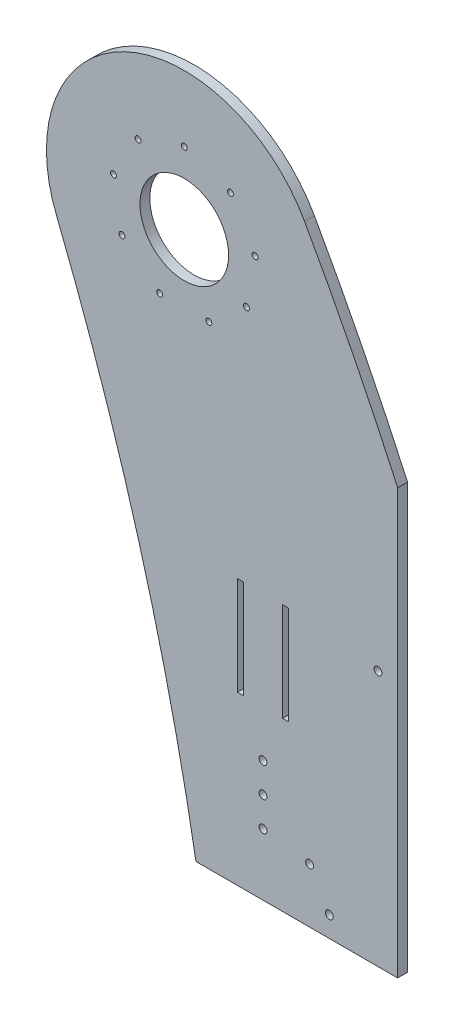
from build123d import *

# Parameters (mm, degrees)
SKETCH_1_R          = 2
SKETCH_1_W          = 3
SKETCH_1_H          = 50
SKETCH_1_R_2        = 70
SKETCH_1_R_3        = 22.5
EXTRUDE_1_DEPTH     = 5
SKETCH_2_R          = 2
CUT_EXTRUDE_1_DEPTH = 697.437362582
SKETCH_3_R          = 1.5
CUT_EXTRUDE_2_DEPTH = 697.437362582
SKETCH_4_R          = 2
CUT_EXTRUDE_3_DEPTH = 10


with BuildPart() as part:
    # 草图1 → 凸台-拉伸1 (new body)
    # profile 1 of 2: a face of its own
    with BuildSketch(Plane.XY):
        with BuildLine():
            ThreePointArc((-184.975195398, 573.957266214), (-108.724882678, 291.977251427), (-100, 0))
            Line((-100, 0), (-100, -10))
            Line((-100, -10), (-91, -10))
            Line((-91, -10), (-91, 11))
            Line((-91, 11), (-69, 11))
            Line((-69, 11), (-69, -10))
            Line((-69, -10), (100, -10))
            Line((100, -10), (100, 0))
            ThreePointArc((100, 0), (62.740102222, 327.663103245), (-58.911784918, 634.179379428))
            ThreePointArc((-58.911784918, 634.179379428), (-52.264577008, 617.661043914), (-50, 600))
            ThreePointArc((-50, 600), (-106.738470636, 531.267679808), (-184.975195398, 573.957266214))
        make_face()
        with Locations((-50, 0)):
            Circle(SKETCH_1_R, mode=Mode.SUBTRACT)
        Circle(SKETCH_1_R, mode=Mode.SUBTRACT)
        with Locations((50, 0)):
            Circle(SKETCH_1_R, mode=Mode.SUBTRACT)
        with Locations((-91.5, 435)):
            Rectangle(SKETCH_1_W, SKETCH_1_H, mode=Mode.SUBTRACT)
        with Locations((-68.5, 435)):
            Rectangle(SKETCH_1_W, SKETCH_1_H, mode=Mode.SUBTRACT)
    # profile 2 of 2: a face of its own
    with BuildSketch(Plane.XY):
        with Locations((-120, 600)):
            Circle(SKETCH_1_R_2)
        with Locations((-120, 600)):
            Circle(SKETCH_1_R_3, mode=Mode.SUBTRACT)
    extrude(amount=EXTRUDE_1_DEPTH)

    # 草图2 → 切除-拉伸1 (cut, through all)
    with BuildSketch(Plane(origin=(0, 0, 0), x_dir=(-1, 0, 0), z_dir=(0, 0, -1))):
        with Locations((80, 386.410161514)):
            Circle(SKETCH_2_R)
        with Locations((80, 371.410161514)):
            Circle(SKETCH_2_R)
        with Locations((80, 356.410161514)):
            Circle(SKETCH_2_R)
        with Locations((56.339745962, 352.749907476)):
            Circle(SKETCH_2_R)
        with Locations((46.339745962, 335.4293994)):
            Circle(SKETCH_2_R)
        with Locations((26.339745962, 300.788383249)):
            Circle(SKETCH_2_R)
        with Locations((6.339745962, 266.147367097)):
            Circle(SKETCH_2_R)
        with Locations((-13.660254038, 231.506350946)):
            Circle(SKETCH_2_R)
        with Locations((80, 76.410161514)):
            Circle(SKETCH_2_R)
        with Locations((80, 116.410161514)):
            Circle(SKETCH_2_R)
        with Locations((80, 236.410161514)):
            Circle(SKETCH_2_R)
        with Locations((80, 276.410161514)):
            Circle(SKETCH_2_R)
        with Locations((80, 316.410161514)):
            Circle(SKETCH_2_R)
    extrude(amount=-CUT_EXTRUDE_1_DEPTH, mode=Mode.SUBTRACT)

    # 草图3 → 切除-拉伸2 (cut, through all)
    with BuildSketch(Plane.XY.offset(5)):
        with Locations((-120, 636.5)):
            Circle(SKETCH_3_R)
        with Locations((-96.538252246, 627.960622174)):
            Circle(SKETCH_3_R)
        with Locations((-84.054517015, 606.338158485)):
            Circle(SKETCH_3_R)
        with Locations((-88.390072762, 581.75)):
            Circle(SKETCH_3_R)
        with Locations((-107.516264769, 565.701219341)):
            Circle(SKETCH_3_R)
        with Locations((-132.483735231, 565.701219341)):
            Circle(SKETCH_3_R)
        with Locations((-151.609927238, 581.75)):
            Circle(SKETCH_3_R)
        with Locations((-155.945482985, 606.338158485)):
            Circle(SKETCH_3_R)
        with Locations((-143.461747754, 627.960622174)):
            Circle(SKETCH_3_R)
    extrude(amount=-CUT_EXTRUDE_2_DEPTH, mode=Mode.SUBTRACT)


with BuildPart() as body_2:
    # Split Bodies 1: the piece on the far side of the plane
    add(part.part)
    split(bisect_by=Plane(origin=(0, 325, 0), x_dir=(0, 0, -1), z_dir=(0, -1, 0)), keep=Keep.BOTTOM)

    # 草图4 → 切除-拉伸3 (cut)
    with BuildSketch(Plane.XY.offset(5)):
        with Locations((-21.595687559, 455)):
            Circle(SKETCH_4_R)
        with BuildLine():
            Line((-11.595687559, 325), (-11.595687559, 540.604962521))
            ThreePointArc((-11.595687559, 540.604962521), (30.836385122, 434.518144234), (63.404312441, 325))
            Line((63.404312441, 325), (-11.595687559, 325))
        make_face()
    extrude(amount=-CUT_EXTRUDE_3_DEPTH, mode=Mode.SUBTRACT)


with BuildPart() as part_1:
    add(part.part)

    # Split Bodies 1
    split(bisect_by=Plane(origin=(0, 325, 0), x_dir=(0, 0, -1), z_dir=(0, -1, 0)), keep=Keep.TOP)


solid = body_2.part
